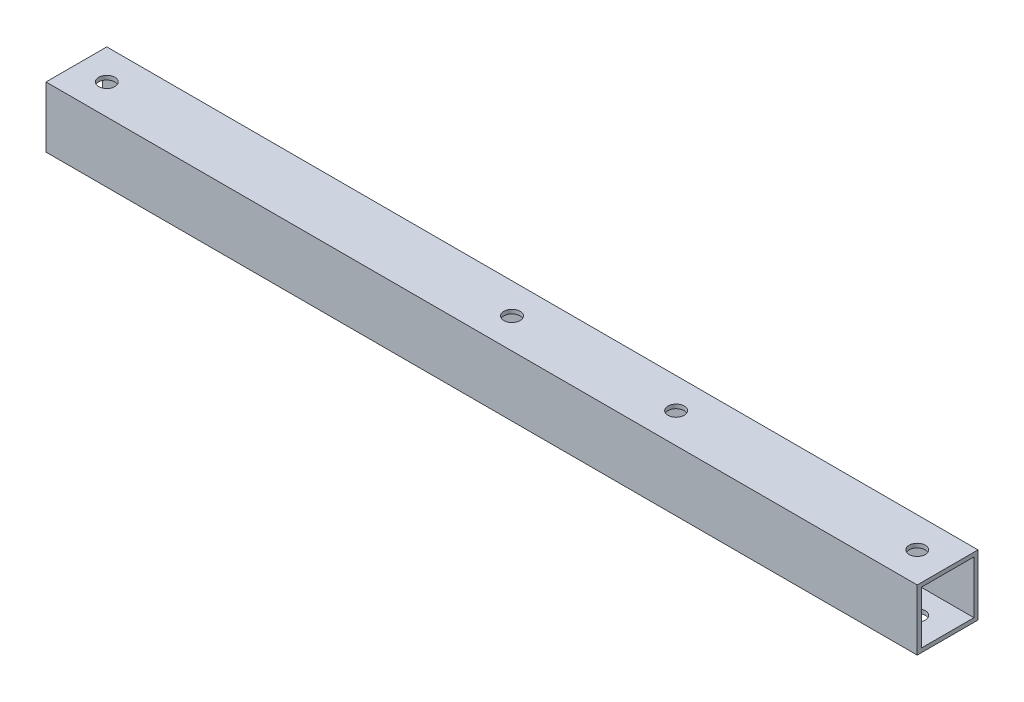
from build123d import *

# Parameters (mm, degrees)
SKETCH_1_W          = 15
SKETCH_1_H          = 15
SKETCH_1_W_2        = 13
SKETCH_1_H_2        = 13
EXTRUDE_1_DEPTH     = 215
CUT_EXTRUDE_1_REACH = 218.044
SKETCH_2_R          = 2


with BuildPart() as part:
    # ｽｹｯﾁ1 → 押し出し-薄板1 (new body)
    with BuildSketch(Plane(origin=(0, 0, 0), x_dir=(0, 0, -1), z_dir=(1, 0, 0))):
        with Locations((7.5, 7.5)):
            Rectangle(SKETCH_1_W, SKETCH_1_H)
        with Locations((7.5, 7.5)):
            Rectangle(SKETCH_1_W_2, SKETCH_1_H_2, mode=Mode.SUBTRACT)
    extrude(amount=EXTRUDE_1_DEPTH)

    # ｶｯﾄ - 押し出し1: up to this face of the body (flat: up to its plane)
    cut_extrude_1_end = Plane(part.part.faces().sort_by_distance((107.5, 0, -7.5))[0])
    # ｽｹｯﾁ2 → ｶｯﾄ - 押し出し1 (cut, up to the picked face)
    with BuildSketch(Plane(origin=(0, 15, 0), x_dir=(1, 0, 0), z_dir=(0, 1, 0)), mode=Mode.PRIVATE) as cut_extrude_1_sk1:
        with Locations(Location((107.5, 7.5, 0), (0, 0, 270))):
            Circle(SKETCH_2_R)
    cut_extrude_1_tool1 = split(extrude(cut_extrude_1_sk1.sketch, amount=-CUT_EXTRUDE_1_REACH, mode=Mode.PRIVATE), bisect_by=cut_extrude_1_end, keep=Keep.BOTH, mode=Mode.PRIVATE)
    # ｽｹｯﾁ2 → ｶｯﾄ - 押し出し1 (cut, up to the picked face)
    with BuildSketch(Plane(origin=(0, 15, 0), x_dir=(1, 0, 0), z_dir=(0, 1, 0)), mode=Mode.PRIVATE) as cut_extrude_1_sk2:
        with Locations(Location((7.5, 7.5, 0), (0, 0, 270))):
            Circle(SKETCH_2_R)
    cut_extrude_1_tool2 = split(extrude(cut_extrude_1_sk2.sketch, amount=-CUT_EXTRUDE_1_REACH, mode=Mode.PRIVATE), bisect_by=cut_extrude_1_end, keep=Keep.BOTH, mode=Mode.PRIVATE)
    # ｽｹｯﾁ2 → ｶｯﾄ - 押し出し1 (cut, up to the picked face)
    with BuildSketch(Plane(origin=(0, 15, 0), x_dir=(1, 0, 0), z_dir=(0, 1, 0)), mode=Mode.PRIVATE) as cut_extrude_1_sk3:
        with Locations(Location((207.5, 7.5, 0), (0, 0, 90))):
            Circle(SKETCH_2_R)
    cut_extrude_1_tool3 = split(extrude(cut_extrude_1_sk3.sketch, amount=-CUT_EXTRUDE_1_REACH, mode=Mode.PRIVATE), bisect_by=cut_extrude_1_end, keep=Keep.BOTH, mode=Mode.PRIVATE)
    # ｽｹｯﾁ2 → ｶｯﾄ - 押し出し1 (cut, up to the picked face)
    with BuildSketch(Plane(origin=(0, 15, 0), x_dir=(1, 0, 0), z_dir=(0, 1, 0)), mode=Mode.PRIVATE) as cut_extrude_1_sk4:
        with Locations(Location((148, 7.5, 0), (0, 0, 270))):
            Circle(SKETCH_2_R)
    cut_extrude_1_tool4 = split(extrude(cut_extrude_1_sk4.sketch, amount=-CUT_EXTRUDE_1_REACH, mode=Mode.PRIVATE), bisect_by=cut_extrude_1_end, keep=Keep.BOTH, mode=Mode.PRIVATE)
    add(cut_extrude_1_tool1.solids().sort_by(Axis((107.5, 15, -7.5), (0, -1, 0)))[0], mode=Mode.SUBTRACT)
    add(cut_extrude_1_tool2.solids().sort_by(Axis((7.5, 15, -7.5), (0, -1, 0)))[0], mode=Mode.SUBTRACT)
    add(cut_extrude_1_tool3.solids().sort_by(Axis((207.5, 15, -7.5), (0, -1, 0)))[0], mode=Mode.SUBTRACT)
    add(cut_extrude_1_tool4.solids().sort_by(Axis((148, 15, -7.5), (0, -1, 0)))[0], mode=Mode.SUBTRACT)


solid = part.part
